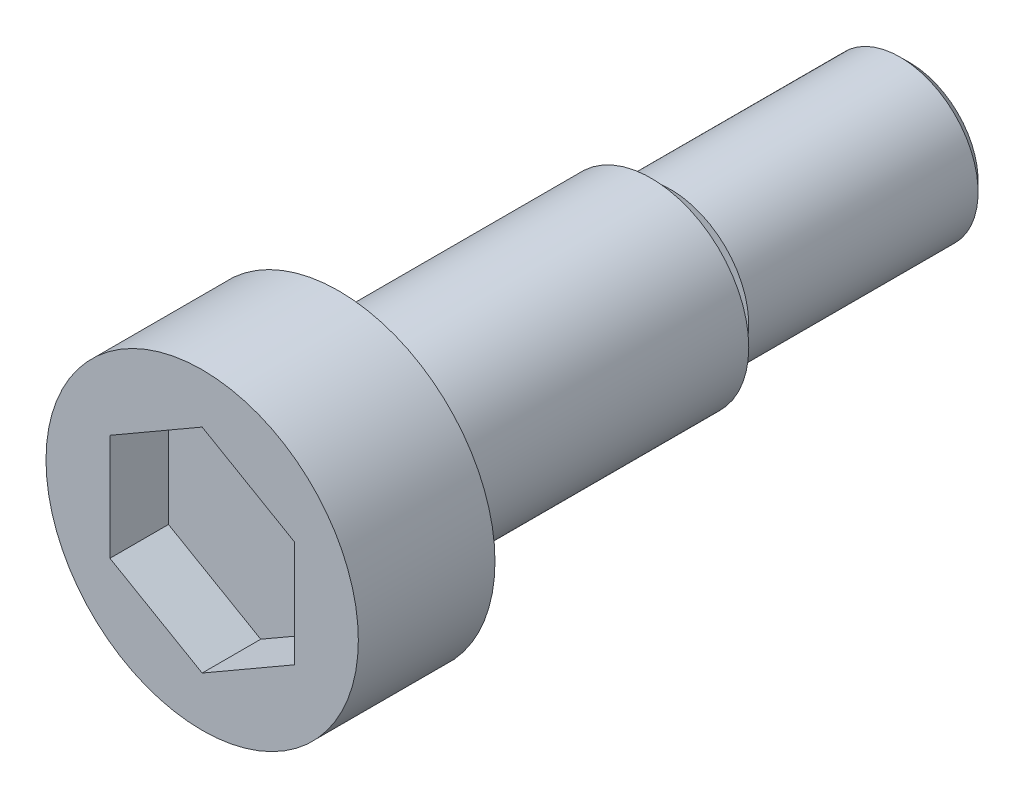
from build123d import *

# Parameters (mm, degrees)
SKETCH_2_R          = 5
EXTRUDE_1_DEPTH     = 16
SKETCH_3_R          = 8
EXTRUDE_2_DEPTH     = 7
SKETCH_4_R          = 4
EXTRUDE_3_DEPTH     = 13.25
CUT_EXTRUDE_1_DEPTH = 3
CHAMFER_1_SIZE      = 0.5
SKETCH_6_R          = 4
SKETCH_6_R_2        = 3.5
CUT_EXTRUDE_2_DEPTH = 1


with BuildPart() as part:
    # 草图2 → 凸台-拉伸1 (new body)
    with BuildSketch(Plane.XY):
        Circle(SKETCH_2_R)
    extrude(amount=EXTRUDE_1_DEPTH)

    # 草图3 → 凸台-拉伸2 (add)
    with BuildSketch(Plane.XY.offset(16)):
        Circle(SKETCH_3_R)
    extrude(amount=EXTRUDE_2_DEPTH)

    # 草图4 → 凸台-拉伸3 (add)
    with BuildSketch(Plane(origin=(0, 0, 0), x_dir=(-1, 0, 0), z_dir=(0, 0, -1))):
        Circle(SKETCH_4_R)
    extrude(amount=EXTRUDE_3_DEPTH)

    # 草图5 → 切除-拉伸1 (cut)
    with BuildSketch(Plane.XY.offset(23)):
        Polygon((0, 5.456235198), (-4.72523829, 2.728117599), (-4.72523829, -2.728117599), (0, -5.456235198), (4.72523829, -2.728117599), (4.72523829, 2.728117599), align=None)
    extrude(amount=-CUT_EXTRUDE_1_DEPTH, mode=Mode.SUBTRACT)

    # 倒角1
    chamfer_1_edges = [part.edges().sort_by_distance(p)[0] for p in [
        (4, 0, -13.25),
    ]]
    chamfer(chamfer_1_edges, length=CHAMFER_1_SIZE)

    # 草图6 → 切除-拉伸2 (cut)
    with BuildSketch(Plane(origin=(0, 0, 0), x_dir=(-1, 0, 0), z_dir=(0, 0, -1))):
        Circle(SKETCH_6_R)
        Circle(SKETCH_6_R_2, mode=Mode.SUBTRACT)
    extrude(amount=CUT_EXTRUDE_2_DEPTH, mode=Mode.SUBTRACT)


solid = part.part
